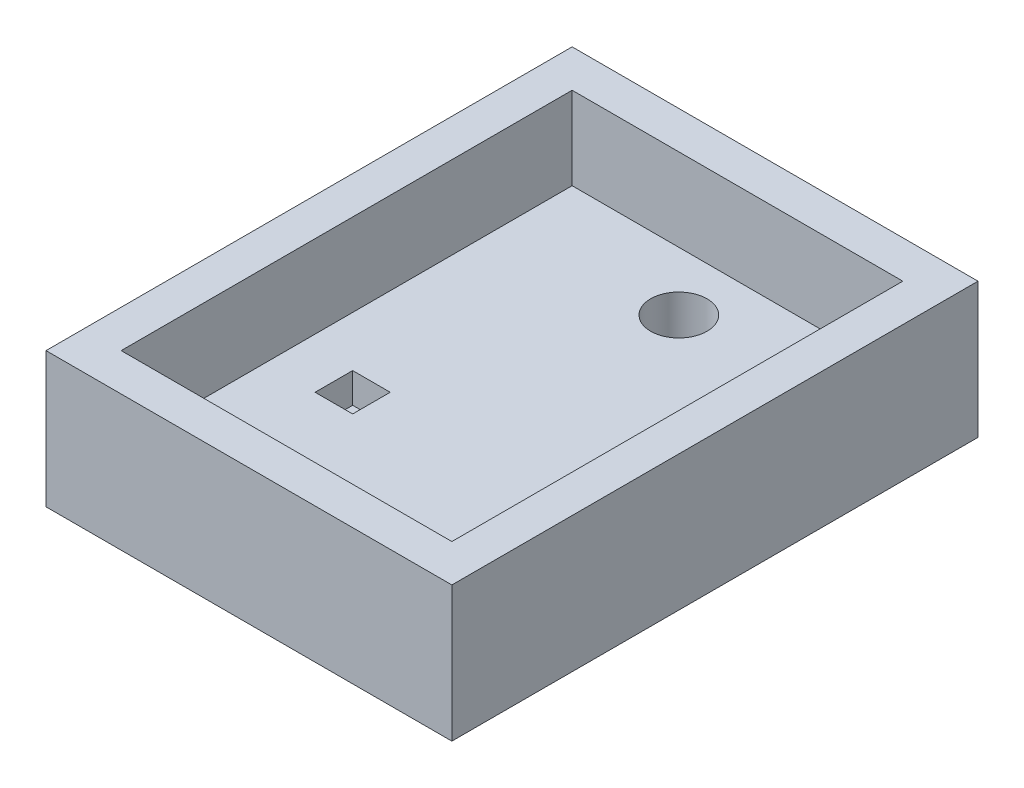
from build123d import *

# Parameters (mm, degrees)
SKETCH1_W           = 68.58
SKETCH1_H           = 88.9
BOSS_EXTRUDE1_DEPTH = 22.86
SKETCH2_W           = 55.88
SKETCH2_H           = 76.2
CUT_EXTRUDE1_DEPTH  = 13.97
SKETCH6_W           = 6.35
SKETCH6_H           = 6.35
CUT_EXTRUDE3_DEPTH  = 5.08
SKETCH7_W           = 2.54
SKETCH7_H           = 2.54
CUT_EXTRUDE4_DEPTH  = 114.882961412
SKETCH5_R           = 4.7625
CUT_EXTRUDE5_DEPTH  = 114.144099714


with BuildPart() as part:
    # Sketch1 → Boss-Extrude1 (new body)
    with BuildSketch(Plane(origin=(0, 0, 0), x_dir=(1, 0, 0), z_dir=(0, 1, 0))):
        with Locations((34.29, 44.45)):
            Rectangle(SKETCH1_W, SKETCH1_H)
    extrude(amount=BOSS_EXTRUDE1_DEPTH)

    # Sketch2 → Cut-Extrude1 (cut)
    with BuildSketch(Plane(origin=(0, 22.86, 0), x_dir=(1, 0, 0), z_dir=(0, 1, 0))):
        with Locations((34.29, 44.45)):
            Rectangle(SKETCH2_W, SKETCH2_H)
    extrude(amount=-CUT_EXTRUDE1_DEPTH, mode=Mode.SUBTRACT)

    # Sketch6 → Cut-Extrude3 (cut)
    with BuildSketch(Plane(origin=(0, 8.89, 0), x_dir=(1, 0, 0), z_dir=(0, 1, 0))):
        with Locations((18.034, 33.782)):
            Rectangle(SKETCH6_W, SKETCH6_H)
        with Locations((18.034, 13.716)):
            Rectangle(SKETCH6_W, SKETCH6_H)
    extrude(amount=-CUT_EXTRUDE3_DEPTH, mode=Mode.SUBTRACT)

    # Sketch7 → Cut-Extrude4 (cut, through all)
    with BuildSketch(Plane(origin=(0, 3.81, 0), x_dir=(1, 0, 0), z_dir=(0, 1, 0))):
        with Locations((18.034, 33.782)):
            Rectangle(SKETCH7_W, SKETCH7_H)
        with Locations((18.034, 13.716)):
            Rectangle(SKETCH7_W, SKETCH7_H)
    extrude(amount=-CUT_EXTRUDE4_DEPTH, mode=Mode.SUBTRACT)

    # Sketch5 → Cut-Extrude5 (cut, through all)
    with BuildSketch(Plane(origin=(0, 8.89, 0), x_dir=(1, 0, 0), z_dir=(0, 1, 0))):
        with Locations(Location((34.29, 72.644, 0), (0, 0, 270))):
            Circle(SKETCH5_R)
    extrude(amount=-CUT_EXTRUDE5_DEPTH, mode=Mode.SUBTRACT)


solid = part.part
